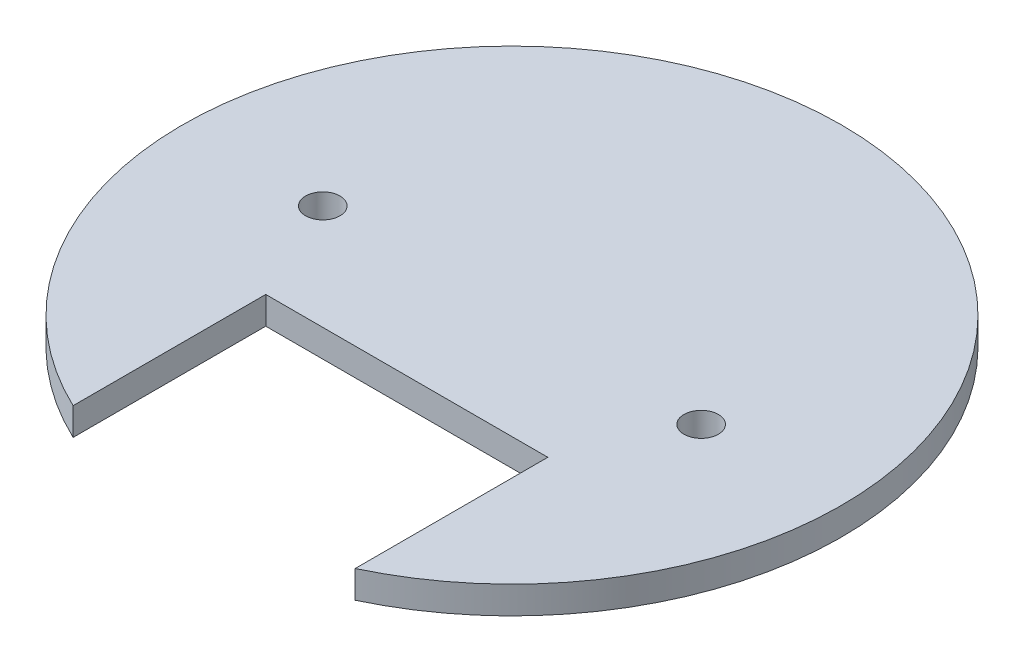
from build123d import *

# Parameters (mm, degrees)
SKETCH1_R           = 2.5
BOSS_EXTRUDE2_DEPTH = 4


with BuildPart() as part:
    # Sketch1 → Boss-Extrude2 (new body)
    with BuildSketch(Plane(origin=(0, 0, 0), x_dir=(1, 0, 0), z_dir=(0, 1, 0))):
        with BuildLine():
            Line((-20.5, -43.291569618), (-20.5, -15.291569618))
            Line((-20.5, -15.291569618), (20.5, -15.291569618))
            Line((20.5, -15.291569618), (20.5, -43.291569618))
            ThreePointArc((20.5, -43.291569618), (0, 47.9), (-20.5, -43.291569618))
        make_face()
        with Locations(Location((-27.5, 0, 0), (0, 0, 270))):
            Circle(SKETCH1_R, mode=Mode.SUBTRACT)
        with Locations(Location((27.5, 0, 0), (0, 0, 90))):
            Circle(SKETCH1_R, mode=Mode.SUBTRACT)
    extrude(amount=BOSS_EXTRUDE2_DEPTH)


solid = part.part
